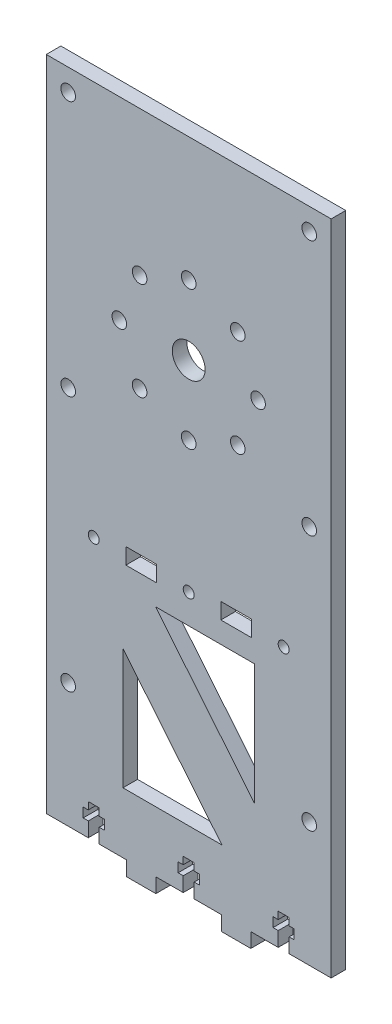
from build123d import *

# Parameters (mm, degrees)
SKETCH_1_W          = 78
SKETCH_1_H          = 180
SKETCH_1_R          = 4.5
SKETCH_1_R_2        = 2
EXTRUDE_1_DEPTH     = 4
SKETCH_2_R          = 1.5
SKETCH_2_W          = 8.4
SKETCH_2_H          = 4.4
CUT_EXTRUDE_1_DEPTH = 4
SKETCH_6_W          = 8
SKETCH_6_H          = 8
EXTRUDE_2_DEPTH     = 4
SKETCH_7_R          = 2
CUT_EXTRUDE_2_DEPTH = 10


with BuildPart() as part:
    # 草图1 → 凸台-拉伸1 (new body)
    with BuildSketch(Plane.XY):
        with Locations((-4, -57.5)):
            Rectangle(SKETCH_1_W, SKETCH_1_H)
        with Locations((-4, -20.5)):
            Circle(SKETCH_1_R, mode=Mode.SUBTRACT)
        with Locations((15, -20.5)):
            Circle(SKETCH_1_R_2, mode=Mode.SUBTRACT)
        with Locations((9.435028843, -33.935028843)):
            Circle(SKETCH_1_R_2, mode=Mode.SUBTRACT)
        with Locations((-4, -39.5)):
            Circle(SKETCH_1_R_2, mode=Mode.SUBTRACT)
        with Locations((-17.435028843, -33.935028843)):
            Circle(SKETCH_1_R_2, mode=Mode.SUBTRACT)
        with Locations((-23, -20.5)):
            Circle(SKETCH_1_R_2, mode=Mode.SUBTRACT)
        with Locations((-17.435028843, -7.064971157)):
            Circle(SKETCH_1_R_2, mode=Mode.SUBTRACT)
        with Locations((-4, -1.5)):
            Circle(SKETCH_1_R_2, mode=Mode.SUBTRACT)
        with Locations((9.435028843, -7.064971157)):
            Circle(SKETCH_1_R_2, mode=Mode.SUBTRACT)
    extrude(amount=EXTRUDE_1_DEPTH)

    # 草图2 → 切除-拉伸1 (cut)
    with BuildSketch(Plane.XY.offset(4)):
        with Locations((-4, -75.5)):
            Circle(SKETCH_2_R)
        with Locations((22, -75.5)):
            Circle(SKETCH_2_R)
        with Locations((-30, -75.5)):
            Circle(SKETCH_2_R)
        with Locations((-17, -75.5)):
            Rectangle(SKETCH_2_W, SKETCH_2_H)
        with Locations((9, -75.5)):
            Rectangle(SKETCH_2_W, SKETCH_2_H)
        Polygon((-31.5, -147.5), (-31.5, -143.5), (-32.9, -143.5), (-32.9, -140.9), (-31.5, -140.9), (-31.5, -138.9), (-28.5, -138.9), (-28.5, -140.9), (-27.1, -140.9), (-27.1, -143.5), (-28.5, -143.5), (-28.5, -147.5), align=None)
        Polygon((23.5, -147.5), (20.5, -147.5), (20.5, -143.5), (19.1, -143.5), (19.1, -140.9), (20.5, -140.9), (20.5, -138.9), (23.5, -138.9), (23.5, -140.9), (24.9, -140.9), (24.9, -143.5), (23.5, -143.5), align=None)
        Polygon((-5.5, -147.5), (-5.5, -143.5), (-6.9, -143.5), (-6.9, -140.9), (-5.5, -140.9), (-5.5, -138.9), (-2.5, -138.9), (-2.5, -140.9), (-1.1, -140.9), (-1.1, -143.5), (-2.5, -143.5), (-2.5, -147.5), align=None)
    extrude(amount=-CUT_EXTRUDE_1_DEPTH, mode=Mode.SUBTRACT)

    # 草图6 → 凸台-拉伸2 (add)
    with BuildSketch(Plane.XY.offset(4)):
        with Locations((-17, -147.5)):
            Rectangle(SKETCH_6_W, SKETCH_6_H)
        with Locations((9, -147.5)):
            Rectangle(SKETCH_6_W, SKETCH_6_H)
    extrude(amount=-EXTRUDE_2_DEPTH)

    # 草图7 → 切除-拉伸2 (cut)
    with BuildSketch(Plane(origin=(0, 0, 0), x_dir=(-1, 0, 0), z_dir=(0, 0, -1))):
        with Locations((-29, 26.5)):
            Circle(SKETCH_7_R)
        with Locations((-29, -43.5)):
            Circle(SKETCH_7_R)
        with Locations((-29, -113.5)):
            Circle(SKETCH_7_R)
        with Locations((37, -43.5)):
            Circle(SKETCH_7_R)
        with Locations((37, -113.5)):
            Circle(SKETCH_7_R)
        with Locations((37, 26.5)):
            Circle(SKETCH_7_R)
        Polygon((-14, -83.5), (-14, -116.531181995), (13.091821195, -83.5), align=None)
        Polygon((-5.091821195, -130.9), (22, -97.868818005), (22, -130.9), align=None)
    extrude(amount=-CUT_EXTRUDE_2_DEPTH, mode=Mode.SUBTRACT)


solid = part.part
